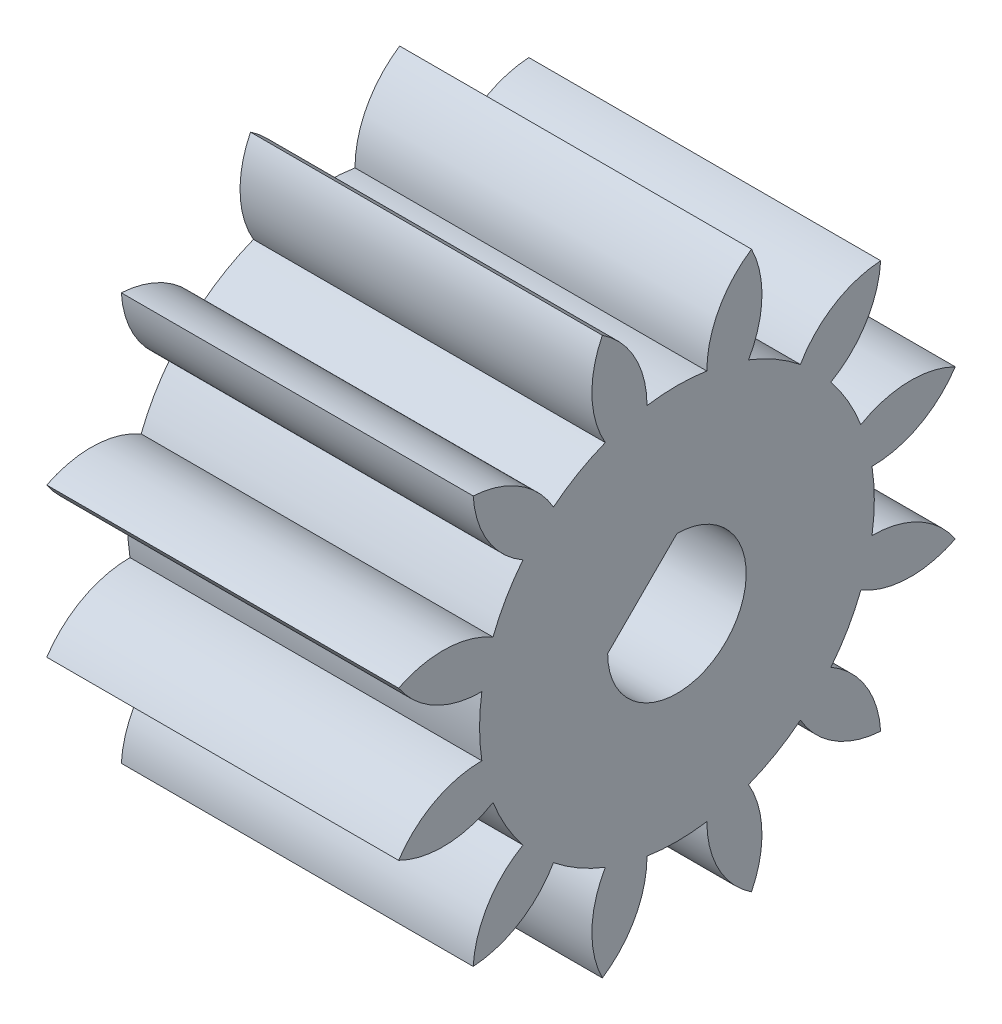
from build123d import *

# Parameters (mm, degrees)
BASPROSKE_W         = 12.7
BASPROSKE_H         = 10.5
TOOTHCUT_DEPTH      = 20.53944728
TEETHCUTS_COUNT     = 12
TEETHCUTS_ANGLE     = 330
BORSKE_R            = 2.5
BORE_DEPTH          = 25.4000508
BOSS_EXTRUDE2_DEPTH = 12.7


with BuildPart() as part:
    # BasProSke → Base-Revolve (revolve)
    with BuildSketch(Plane(origin=(0, 0, 0), x_dir=(1, 0, 0), z_dir=(0, 1, 0)), mode=Mode.PRIVATE) as base_revolve_sk:
        with Locations((6.35, 5.25)):
            Rectangle(BASPROSKE_W, BASPROSKE_H)
    revolve(base_revolve_sk.sketch.rotate(Axis((-10, 0, 0), (1, 0, 0)), 180), axis=Axis((-10, 0, 0), (1, 0, 0)))

    # TooCutSke → ToothCut (cut, through all)
    with BuildSketch(Plane(origin=(0, 0, 0), x_dir=(0, 0, -1), z_dir=(1, 0, 0))):
        with BuildLine():
            ThreePointArc((1.080075342, 7.041375318), (0, 7.12373), (-1.080075342, 7.041375318))
            ThreePointArc((-1.080075342, 7.041375318), (-1.548983663, 8.820857613), (-2.836042131, 10.136119089))
            ThreePointArc((-2.836042131, 10.136119089), (0, 10.5254), (2.836042131, 10.136119089))
            ThreePointArc((2.836042131, 10.136119089), (1.548983663, 8.820857613), (1.080075342, 7.041375318))
        make_face()
    toothcut = extrude(amount=TOOTHCUT_DEPTH, mode=Mode.SUBTRACT)

    # TeethCuts: ToothCut ×12 about axis
    teethcuts_axis = Axis((-10, 0, 0), (1, 0, 0))
    for i in range(1, TEETHCUTS_COUNT):
        add(toothcut.rotate(teethcuts_axis, i * TEETHCUTS_ANGLE / (TEETHCUTS_COUNT - 1)), mode=Mode.SUBTRACT)

    # BorSke → Bore (cut, symmetric)
    with BuildSketch(Plane(origin=(0, 0, 0), x_dir=(0, 0, -1), z_dir=(1, 0, 0))):
        with Locations(Location((0, 0, 0), (0, 0, 180))):
            Circle(BORSKE_R)
    extrude(amount=BORE_DEPTH, both=True, mode=Mode.SUBTRACT)

    # Sketch2 → Boss-Extrude2 (add, through all)
    with BuildSketch(Plane(origin=(12.7, 0, 0), x_dir=(0, 0, -1), z_dir=(1, 0, 0))):
        with BuildLine():
            Line((-2.5, 0), (0, 2.5))
            ThreePointArc((0, 2.5), (-1.767766953, 1.767766953), (-2.5, 0))
        make_face()
    extrude(amount=-BOSS_EXTRUDE2_DEPTH)


solid = part.part
